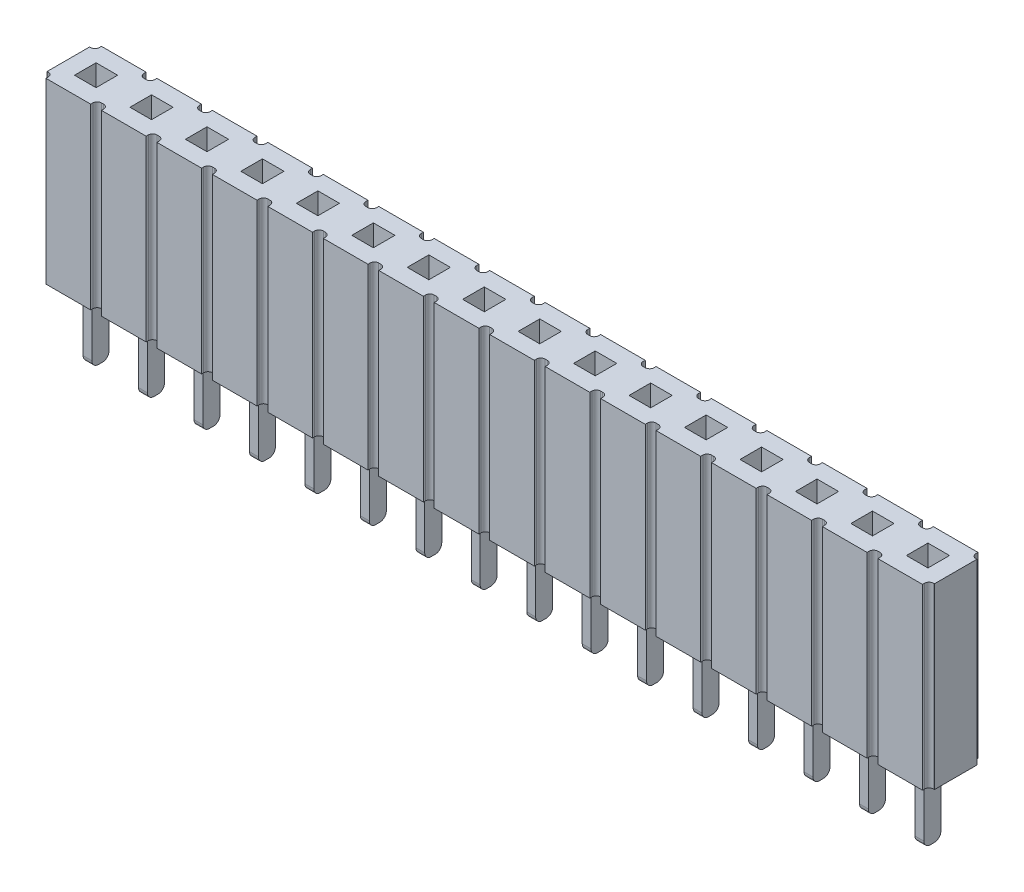
from build123d import *

# Parameters (mm, degrees)
BOSS_EXTRUDE1_DEPTH      = 1.285
BOSS_EXTRUDE1_DEPTH_BACK = 1.285
SKETCH1_W                = 41.12
SKETCH1_H                = 8.26
CUT_EXTRUDE2_DEPTH       = 23.194423286
LPATTERN2_COUNT          = 9
LPATTERN2_PITCH          = 2.57
LPATTERN2_COUNT_DIR2     = 9
LPATTERN2_PITCH_DIR2     = 2.57
MIRROR2_COPY_1_DEPTH     = 23.194423286
MIRROR2_COPY_2_DEPTH     = 23.194423286
MIRROR2_COPY_3_DEPTH     = 23.194423286
MIRROR2_COPY_4_DEPTH     = 23.194423286
MIRROR2_COPY_5_DEPTH     = 23.194423286
MIRROR2_COPY_6_DEPTH     = 23.194423286
MIRROR2_COPY_7_DEPTH     = 23.194423286
MIRROR2_COPY_8_DEPTH     = 23.194423286
MIRROR2_COPY_9_DEPTH     = 23.194423286
MIRROR2_COPY_10_DEPTH    = 23.194423286
MIRROR2_COPY_11_DEPTH    = 23.194423286
MIRROR2_COPY_12_DEPTH    = 23.194423286
MIRROR2_COPY_13_DEPTH    = 23.194423286
MIRROR2_COPY_14_DEPTH    = 23.194423286
MIRROR2_COPY_15_DEPTH    = 23.194423286
MIRROR2_COPY_16_DEPTH    = 23.194423286
MIRROR2_COPY_17_DEPTH    = 23.194423286
MIRROR2_COPY_18_DEPTH    = 23.194423286
MIRROR2_COPY_19_DEPTH    = 23.194423286
MIRROR2_COPY_20_DEPTH    = 23.194423286
MIRROR2_COPY_21_DEPTH    = 23.194423286
MIRROR2_COPY_22_DEPTH    = 23.194423286
MIRROR2_COPY_23_DEPTH    = 23.194423286
MIRROR2_COPY_24_DEPTH    = 23.194423286
MIRROR2_COPY_25_DEPTH    = 23.194423286
MIRROR2_COPY_26_DEPTH    = 23.194423286
MIRROR2_COPY_27_DEPTH    = 23.194423286
MIRROR2_COPY_28_DEPTH    = 23.194423286
MIRROR2_COPY_29_DEPTH    = 23.194423286
MIRROR2_COPY_30_DEPTH    = 23.194423286
MIRROR2_COPY_31_DEPTH    = 23.194423286
MIRROR2_COPY_32_DEPTH    = 23.194423286
MIRROR2_COPY_33_DEPTH    = 23.194423286
MIRROR2_COPY_34_DEPTH    = 23.194423286
MIRROR2_COPY_35_DEPTH    = 23.194423286
MIRROR2_COPY_36_DEPTH    = 23.194423286
MIRROR2_COPY_37_DEPTH    = 23.194423286
MIRROR2_COPY_38_DEPTH    = 23.194423286
MIRROR2_COPY_39_DEPTH    = 23.194423286
MIRROR2_COPY_40_DEPTH    = 23.194423286
MIRROR2_COPY_41_DEPTH    = 23.194423286
MIRROR2_COPY_42_DEPTH    = 23.194423286
MIRROR2_COPY_43_DEPTH    = 23.194423286
MIRROR2_COPY_44_DEPTH    = 23.194423286
MIRROR2_COPY_45_DEPTH    = 23.194423286
MIRROR2_COPY_46_DEPTH    = 23.194423286
MIRROR2_COPY_47_DEPTH    = 23.194423286
MIRROR2_COPY_48_DEPTH    = 23.194423286
MIRROR2_COPY_49_DEPTH    = 23.194423286
MIRROR2_COPY_50_DEPTH    = 23.194423286
MIRROR2_COPY_51_DEPTH    = 23.194423286
MIRROR2_COPY_52_DEPTH    = 23.194423286
MIRROR2_COPY_53_DEPTH    = 23.194423286
MIRROR2_COPY_54_DEPTH    = 23.194423286
MIRROR2_COPY_55_DEPTH    = 23.194423286
MIRROR2_COPY_56_DEPTH    = 23.194423286
MIRROR2_COPY_57_DEPTH    = 23.194423286
MIRROR2_COPY_58_DEPTH    = 23.194423286
MIRROR2_COPY_59_DEPTH    = 23.194423286
MIRROR2_COPY_60_DEPTH    = 23.194423286
MIRROR2_COPY_61_DEPTH    = 23.194423286
MIRROR2_COPY_62_DEPTH    = 23.194423286
MIRROR2_COPY_63_DEPTH    = 23.194423286
MIRROR2_COPY_64_DEPTH    = 23.194423286
MIRROR2_COPY_65_DEPTH    = 23.194423286
MIRROR2_COPY_66_DEPTH    = 23.194423286
MIRROR2_COPY_67_DEPTH    = 23.194423286
MIRROR2_COPY_68_DEPTH    = 23.194423286
MIRROR2_COPY_69_DEPTH    = 23.194423286
MIRROR2_COPY_70_DEPTH    = 23.194423286
MIRROR2_COPY_71_DEPTH    = 23.194423286
MIRROR2_COPY_72_DEPTH    = 23.194423286
MIRROR2_COPY_73_DEPTH    = 23.194423286
MIRROR2_COPY_74_DEPTH    = 23.194423286
MIRROR2_COPY_75_DEPTH    = 23.194423286
MIRROR2_COPY_76_DEPTH    = 23.194423286
MIRROR2_COPY_77_DEPTH    = 23.194423286
MIRROR2_COPY_78_DEPTH    = 23.194423286
MIRROR2_COPY_79_DEPTH    = 23.194423286
MIRROR2_COPY_80_DEPTH    = 23.194423286
MIRROR2_COPY_81_DEPTH    = 23.194423286
SKETCH4_W                = 1
SKETCH4_H                = 1
CUT_EXTRUDE3_DEPTH       = 8
LPATTERN3_COUNT          = 9
LPATTERN3_PITCH          = 2.57
LPATTERN3_COUNT_DIR2     = 8
LPATTERN3_PITCH_DIR2     = 2.57
SKETCH5_W                = 0.41
SKETCH5_H                = 0.79
BOSS_EXTRUDE2_DEPTH      = 3.2
LPATTERN6_COUNT          = 9
LPATTERN6_PITCH          = 2.57
LPATTERN6_COUNT_DIR2     = 8
LPATTERN6_PITCH_DIR2     = 2.57
FILLET2_R                = 0.3


with BuildPart() as part:
    # Sketch1 → Boss-Extrude1 (new, two sides: drawn at the far end of the back side and taken through both)
    with BuildSketch(Plane.XY.offset(-BOSS_EXTRUDE1_DEPTH_BACK)):
        Rectangle(SKETCH1_W, SKETCH1_H)
    extrude(amount=BOSS_EXTRUDE1_DEPTH + BOSS_EXTRUDE1_DEPTH_BACK)

    # Sketch3 → Cut-Extrude2 (cut, through all)
    with BuildSketch(Plane(origin=(0, 4.13, 0), x_dir=(1, 0, 0), z_dir=(0, 1, 0))):
        with BuildLine():
            Line((-0.05, -0.985), (0.05, -0.985))
            ThreePointArc((0.05, -0.985), (0.191421356, -1.043578644), (0.25, -1.185))
            Line((0.25, -1.185), (0.25, -1.285))
            Line((0.25, -1.285), (-0.25, -1.285))
            Line((-0.25, -1.285), (-0.25, -1.185))
            ThreePointArc((-0.25, -1.185), (-0.191421356, -1.043578644), (-0.05, -0.985))
        make_face()
    cut_extrude2 = extrude(amount=-CUT_EXTRUDE2_DEPTH, mode=Mode.SUBTRACT)

    # LPattern2: Cut-Extrude2 9 × 9
    with Locations(*[Vector(-1, 0, 0) * (i * LPATTERN2_PITCH) + Vector(1, 0, 0) * (j * LPATTERN2_PITCH_DIR2) for i in range(LPATTERN2_COUNT) for j in range(LPATTERN2_COUNT_DIR2) if (i, j) != (0, 0)]):
        add(cut_extrude2, mode=Mode.SUBTRACT)

    # Mirror2 copy 1 sketch → Mirror2 copy 1 (cut, through all)
    with BuildSketch(Plane(origin=(2.57, 4.13, 0), x_dir=(1, 0, 0), z_dir=(0, 1, 0))):
        with BuildLine():
            Line((-0.05, 0.985), (0.05, 0.985))
            ThreePointArc((0.05, 0.985), (0.191421356, 1.043578644), (0.25, 1.185))
            Line((0.25, 1.185), (0.25, 1.285))
            Line((0.25, 1.285), (-0.25, 1.285))
            Line((-0.25, 1.285), (-0.25, 1.185))
            ThreePointArc((-0.25, 1.185), (-0.191421356, 1.043578644), (-0.05, 0.985))
        make_face()
    extrude(amount=-MIRROR2_COPY_1_DEPTH, mode=Mode.SUBTRACT)

    # Mirror2 copy 2 sketch → Mirror2 copy 2 (cut, through all)
    with BuildSketch(Plane(origin=(5.14, 4.13, 0), x_dir=(1, 0, 0), z_dir=(0, 1, 0))):
        with BuildLine():
            Line((-0.05, 0.985), (0.05, 0.985))
            ThreePointArc((0.05, 0.985), (0.191421356, 1.043578644), (0.25, 1.185))
            Line((0.25, 1.185), (0.25, 1.285))
            Line((0.25, 1.285), (-0.25, 1.285))
            Line((-0.25, 1.285), (-0.25, 1.185))
            ThreePointArc((-0.25, 1.185), (-0.191421356, 1.043578644), (-0.05, 0.985))
        make_face()
    extrude(amount=-MIRROR2_COPY_2_DEPTH, mode=Mode.SUBTRACT)

    # Mirror2 copy 3 sketch → Mirror2 copy 3 (cut, through all)
    with BuildSketch(Plane(origin=(7.71, 4.13, 0), x_dir=(1, 0, 0), z_dir=(0, 1, 0))):
        with BuildLine():
            Line((-0.05, 0.985), (0.05, 0.985))
            ThreePointArc((0.05, 0.985), (0.191421356, 1.043578644), (0.25, 1.185))
            Line((0.25, 1.185), (0.25, 1.285))
            Line((0.25, 1.285), (-0.25, 1.285))
            Line((-0.25, 1.285), (-0.25, 1.185))
            ThreePointArc((-0.25, 1.185), (-0.191421356, 1.043578644), (-0.05, 0.985))
        make_face()
    extrude(amount=-MIRROR2_COPY_3_DEPTH, mode=Mode.SUBTRACT)

    # Mirror2 copy 4 sketch → Mirror2 copy 4 (cut, through all)
    with BuildSketch(Plane(origin=(10.28, 4.13, 0), x_dir=(1, 0, 0), z_dir=(0, 1, 0))):
        with BuildLine():
            Line((-0.05, 0.985), (0.05, 0.985))
            ThreePointArc((0.05, 0.985), (0.191421356, 1.043578644), (0.25, 1.185))
            Line((0.25, 1.185), (0.25, 1.285))
            Line((0.25, 1.285), (-0.25, 1.285))
            Line((-0.25, 1.285), (-0.25, 1.185))
            ThreePointArc((-0.25, 1.185), (-0.191421356, 1.043578644), (-0.05, 0.985))
        make_face()
    extrude(amount=-MIRROR2_COPY_4_DEPTH, mode=Mode.SUBTRACT)

    # Mirror2 copy 5 sketch → Mirror2 copy 5 (cut, through all)
    with BuildSketch(Plane(origin=(12.85, 4.13, 0), x_dir=(1, 0, 0), z_dir=(0, 1, 0))):
        with BuildLine():
            Line((-0.05, 0.985), (0.05, 0.985))
            ThreePointArc((0.05, 0.985), (0.191421356, 1.043578644), (0.25, 1.185))
            Line((0.25, 1.185), (0.25, 1.285))
            Line((0.25, 1.285), (-0.25, 1.285))
            Line((-0.25, 1.285), (-0.25, 1.185))
            ThreePointArc((-0.25, 1.185), (-0.191421356, 1.043578644), (-0.05, 0.985))
        make_face()
    extrude(amount=-MIRROR2_COPY_5_DEPTH, mode=Mode.SUBTRACT)

    # Mirror2 copy 6 sketch → Mirror2 copy 6 (cut, through all)
    with BuildSketch(Plane(origin=(15.42, 4.13, 0), x_dir=(1, 0, 0), z_dir=(0, 1, 0))):
        with BuildLine():
            Line((-0.05, 0.985), (0.05, 0.985))
            ThreePointArc((0.05, 0.985), (0.191421356, 1.043578644), (0.25, 1.185))
            Line((0.25, 1.185), (0.25, 1.285))
            Line((0.25, 1.285), (-0.25, 1.285))
            Line((-0.25, 1.285), (-0.25, 1.185))
            ThreePointArc((-0.25, 1.185), (-0.191421356, 1.043578644), (-0.05, 0.985))
        make_face()
    extrude(amount=-MIRROR2_COPY_6_DEPTH, mode=Mode.SUBTRACT)

    # Mirror2 copy 7 sketch → Mirror2 copy 7 (cut, through all)
    with BuildSketch(Plane(origin=(17.99, 4.13, 0), x_dir=(1, 0, 0), z_dir=(0, 1, 0))):
        with BuildLine():
            Line((-0.05, 0.985), (0.05, 0.985))
            ThreePointArc((0.05, 0.985), (0.191421356, 1.043578644), (0.25, 1.185))
            Line((0.25, 1.185), (0.25, 1.285))
            Line((0.25, 1.285), (-0.25, 1.285))
            Line((-0.25, 1.285), (-0.25, 1.185))
            ThreePointArc((-0.25, 1.185), (-0.191421356, 1.043578644), (-0.05, 0.985))
        make_face()
    extrude(amount=-MIRROR2_COPY_7_DEPTH, mode=Mode.SUBTRACT)

    # Mirror2 copy 8 sketch → Mirror2 copy 8 (cut, through all)
    with BuildSketch(Plane(origin=(20.56, 4.13, 0), x_dir=(1, 0, 0), z_dir=(0, 1, 0))):
        with BuildLine():
            Line((-0.05, 0.985), (0.05, 0.985))
            ThreePointArc((0.05, 0.985), (0.191421356, 1.043578644), (0.25, 1.185))
            Line((0.25, 1.185), (0.25, 1.285))
            Line((0.25, 1.285), (-0.25, 1.285))
            Line((-0.25, 1.285), (-0.25, 1.185))
            ThreePointArc((-0.25, 1.185), (-0.191421356, 1.043578644), (-0.05, 0.985))
        make_face()
    extrude(amount=-MIRROR2_COPY_8_DEPTH, mode=Mode.SUBTRACT)

    # Mirror2 copy 9 sketch → Mirror2 copy 9 (cut, through all)
    with BuildSketch(Plane(origin=(-2.57, 4.13, 0), x_dir=(1, 0, 0), z_dir=(0, 1, 0))):
        with BuildLine():
            Line((-0.05, 0.985), (0.05, 0.985))
            ThreePointArc((0.05, 0.985), (0.191421356, 1.043578644), (0.25, 1.185))
            Line((0.25, 1.185), (0.25, 1.285))
            Line((0.25, 1.285), (-0.25, 1.285))
            Line((-0.25, 1.285), (-0.25, 1.185))
            ThreePointArc((-0.25, 1.185), (-0.191421356, 1.043578644), (-0.05, 0.985))
        make_face()
    extrude(amount=-MIRROR2_COPY_9_DEPTH, mode=Mode.SUBTRACT)

    # Mirror2 copy 10 sketch → Mirror2 copy 10 (cut, through all)
    with BuildSketch(Plane(origin=(0, 4.13, 0), x_dir=(1, 0, 0), z_dir=(0, 1, 0))):
        with BuildLine():
            Line((-0.05, 0.985), (0.05, 0.985))
            ThreePointArc((0.05, 0.985), (0.191421356, 1.043578644), (0.25, 1.185))
            Line((0.25, 1.185), (0.25, 1.285))
            Line((0.25, 1.285), (-0.25, 1.285))
            Line((-0.25, 1.285), (-0.25, 1.185))
            ThreePointArc((-0.25, 1.185), (-0.191421356, 1.043578644), (-0.05, 0.985))
        make_face()
    extrude(amount=-MIRROR2_COPY_10_DEPTH, mode=Mode.SUBTRACT)

    # Mirror2 copy 11 sketch → Mirror2 copy 11 (cut, through all)
    with BuildSketch(Plane(origin=(2.57, 4.13, 0), x_dir=(1, 0, 0), z_dir=(0, 1, 0))):
        with BuildLine():
            Line((-0.05, 0.985), (0.05, 0.985))
            ThreePointArc((0.05, 0.985), (0.191421356, 1.043578644), (0.25, 1.185))
            Line((0.25, 1.185), (0.25, 1.285))
            Line((0.25, 1.285), (-0.25, 1.285))
            Line((-0.25, 1.285), (-0.25, 1.185))
            ThreePointArc((-0.25, 1.185), (-0.191421356, 1.043578644), (-0.05, 0.985))
        make_face()
    extrude(amount=-MIRROR2_COPY_11_DEPTH, mode=Mode.SUBTRACT)

    # Mirror2 copy 12 sketch → Mirror2 copy 12 (cut, through all)
    with BuildSketch(Plane(origin=(5.14, 4.13, 0), x_dir=(1, 0, 0), z_dir=(0, 1, 0))):
        with BuildLine():
            Line((-0.05, 0.985), (0.05, 0.985))
            ThreePointArc((0.05, 0.985), (0.191421356, 1.043578644), (0.25, 1.185))
            Line((0.25, 1.185), (0.25, 1.285))
            Line((0.25, 1.285), (-0.25, 1.285))
            Line((-0.25, 1.285), (-0.25, 1.185))
            ThreePointArc((-0.25, 1.185), (-0.191421356, 1.043578644), (-0.05, 0.985))
        make_face()
    extrude(amount=-MIRROR2_COPY_12_DEPTH, mode=Mode.SUBTRACT)

    # Mirror2 copy 13 sketch → Mirror2 copy 13 (cut, through all)
    with BuildSketch(Plane(origin=(7.71, 4.13, 0), x_dir=(1, 0, 0), z_dir=(0, 1, 0))):
        with BuildLine():
            Line((-0.05, 0.985), (0.05, 0.985))
            ThreePointArc((0.05, 0.985), (0.191421356, 1.043578644), (0.25, 1.185))
            Line((0.25, 1.185), (0.25, 1.285))
            Line((0.25, 1.285), (-0.25, 1.285))
            Line((-0.25, 1.285), (-0.25, 1.185))
            ThreePointArc((-0.25, 1.185), (-0.191421356, 1.043578644), (-0.05, 0.985))
        make_face()
    extrude(amount=-MIRROR2_COPY_13_DEPTH, mode=Mode.SUBTRACT)

    # Mirror2 copy 14 sketch → Mirror2 copy 14 (cut, through all)
    with BuildSketch(Plane(origin=(10.28, 4.13, 0), x_dir=(1, 0, 0), z_dir=(0, 1, 0))):
        with BuildLine():
            Line((-0.05, 0.985), (0.05, 0.985))
            ThreePointArc((0.05, 0.985), (0.191421356, 1.043578644), (0.25, 1.185))
            Line((0.25, 1.185), (0.25, 1.285))
            Line((0.25, 1.285), (-0.25, 1.285))
            Line((-0.25, 1.285), (-0.25, 1.185))
            ThreePointArc((-0.25, 1.185), (-0.191421356, 1.043578644), (-0.05, 0.985))
        make_face()
    extrude(amount=-MIRROR2_COPY_14_DEPTH, mode=Mode.SUBTRACT)

    # Mirror2 copy 15 sketch → Mirror2 copy 15 (cut, through all)
    with BuildSketch(Plane(origin=(12.85, 4.13, 0), x_dir=(1, 0, 0), z_dir=(0, 1, 0))):
        with BuildLine():
            Line((-0.05, 0.985), (0.05, 0.985))
            ThreePointArc((0.05, 0.985), (0.191421356, 1.043578644), (0.25, 1.185))
            Line((0.25, 1.185), (0.25, 1.285))
            Line((0.25, 1.285), (-0.25, 1.285))
            Line((-0.25, 1.285), (-0.25, 1.185))
            ThreePointArc((-0.25, 1.185), (-0.191421356, 1.043578644), (-0.05, 0.985))
        make_face()
    extrude(amount=-MIRROR2_COPY_15_DEPTH, mode=Mode.SUBTRACT)

    # Mirror2 copy 16 sketch → Mirror2 copy 16 (cut, through all)
    with BuildSketch(Plane(origin=(15.42, 4.13, 0), x_dir=(1, 0, 0), z_dir=(0, 1, 0))):
        with BuildLine():
            Line((-0.05, 0.985), (0.05, 0.985))
            ThreePointArc((0.05, 0.985), (0.191421356, 1.043578644), (0.25, 1.185))
            Line((0.25, 1.185), (0.25, 1.285))
            Line((0.25, 1.285), (-0.25, 1.285))
            Line((-0.25, 1.285), (-0.25, 1.185))
            ThreePointArc((-0.25, 1.185), (-0.191421356, 1.043578644), (-0.05, 0.985))
        make_face()
    extrude(amount=-MIRROR2_COPY_16_DEPTH, mode=Mode.SUBTRACT)

    # Mirror2 copy 17 sketch → Mirror2 copy 17 (cut, through all)
    with BuildSketch(Plane(origin=(17.99, 4.13, 0), x_dir=(1, 0, 0), z_dir=(0, 1, 0))):
        with BuildLine():
            Line((-0.05, 0.985), (0.05, 0.985))
            ThreePointArc((0.05, 0.985), (0.191421356, 1.043578644), (0.25, 1.185))
            Line((0.25, 1.185), (0.25, 1.285))
            Line((0.25, 1.285), (-0.25, 1.285))
            Line((-0.25, 1.285), (-0.25, 1.185))
            ThreePointArc((-0.25, 1.185), (-0.191421356, 1.043578644), (-0.05, 0.985))
        make_face()
    extrude(amount=-MIRROR2_COPY_17_DEPTH, mode=Mode.SUBTRACT)

    # Mirror2 copy 18 sketch → Mirror2 copy 18 (cut, through all)
    with BuildSketch(Plane(origin=(-5.14, 4.13, 0), x_dir=(1, 0, 0), z_dir=(0, 1, 0))):
        with BuildLine():
            Line((-0.05, 0.985), (0.05, 0.985))
            ThreePointArc((0.05, 0.985), (0.191421356, 1.043578644), (0.25, 1.185))
            Line((0.25, 1.185), (0.25, 1.285))
            Line((0.25, 1.285), (-0.25, 1.285))
            Line((-0.25, 1.285), (-0.25, 1.185))
            ThreePointArc((-0.25, 1.185), (-0.191421356, 1.043578644), (-0.05, 0.985))
        make_face()
    extrude(amount=-MIRROR2_COPY_18_DEPTH, mode=Mode.SUBTRACT)

    # Mirror2 copy 19 sketch → Mirror2 copy 19 (cut, through all)
    with BuildSketch(Plane(origin=(-2.57, 4.13, 0), x_dir=(1, 0, 0), z_dir=(0, 1, 0))):
        with BuildLine():
            Line((-0.05, 0.985), (0.05, 0.985))
            ThreePointArc((0.05, 0.985), (0.191421356, 1.043578644), (0.25, 1.185))
            Line((0.25, 1.185), (0.25, 1.285))
            Line((0.25, 1.285), (-0.25, 1.285))
            Line((-0.25, 1.285), (-0.25, 1.185))
            ThreePointArc((-0.25, 1.185), (-0.191421356, 1.043578644), (-0.05, 0.985))
        make_face()
    extrude(amount=-MIRROR2_COPY_19_DEPTH, mode=Mode.SUBTRACT)

    # Mirror2 copy 20 sketch → Mirror2 copy 20 (cut, through all)
    with BuildSketch(Plane(origin=(0, 4.13, 0), x_dir=(1, 0, 0), z_dir=(0, 1, 0))):
        with BuildLine():
            Line((-0.05, 0.985), (0.05, 0.985))
            ThreePointArc((0.05, 0.985), (0.191421356, 1.043578644), (0.25, 1.185))
            Line((0.25, 1.185), (0.25, 1.285))
            Line((0.25, 1.285), (-0.25, 1.285))
            Line((-0.25, 1.285), (-0.25, 1.185))
            ThreePointArc((-0.25, 1.185), (-0.191421356, 1.043578644), (-0.05, 0.985))
        make_face()
    extrude(amount=-MIRROR2_COPY_20_DEPTH, mode=Mode.SUBTRACT)

    # Mirror2 copy 21 sketch → Mirror2 copy 21 (cut, through all)
    with BuildSketch(Plane(origin=(2.57, 4.13, 0), x_dir=(1, 0, 0), z_dir=(0, 1, 0))):
        with BuildLine():
            Line((-0.05, 0.985), (0.05, 0.985))
            ThreePointArc((0.05, 0.985), (0.191421356, 1.043578644), (0.25, 1.185))
            Line((0.25, 1.185), (0.25, 1.285))
            Line((0.25, 1.285), (-0.25, 1.285))
            Line((-0.25, 1.285), (-0.25, 1.185))
            ThreePointArc((-0.25, 1.185), (-0.191421356, 1.043578644), (-0.05, 0.985))
        make_face()
    extrude(amount=-MIRROR2_COPY_21_DEPTH, mode=Mode.SUBTRACT)

    # Mirror2 copy 22 sketch → Mirror2 copy 22 (cut, through all)
    with BuildSketch(Plane(origin=(5.14, 4.13, 0), x_dir=(1, 0, 0), z_dir=(0, 1, 0))):
        with BuildLine():
            Line((-0.05, 0.985), (0.05, 0.985))
            ThreePointArc((0.05, 0.985), (0.191421356, 1.043578644), (0.25, 1.185))
            Line((0.25, 1.185), (0.25, 1.285))
            Line((0.25, 1.285), (-0.25, 1.285))
            Line((-0.25, 1.285), (-0.25, 1.185))
            ThreePointArc((-0.25, 1.185), (-0.191421356, 1.043578644), (-0.05, 0.985))
        make_face()
    extrude(amount=-MIRROR2_COPY_22_DEPTH, mode=Mode.SUBTRACT)

    # Mirror2 copy 23 sketch → Mirror2 copy 23 (cut, through all)
    with BuildSketch(Plane(origin=(7.71, 4.13, 0), x_dir=(1, 0, 0), z_dir=(0, 1, 0))):
        with BuildLine():
            Line((-0.05, 0.985), (0.05, 0.985))
            ThreePointArc((0.05, 0.985), (0.191421356, 1.043578644), (0.25, 1.185))
            Line((0.25, 1.185), (0.25, 1.285))
            Line((0.25, 1.285), (-0.25, 1.285))
            Line((-0.25, 1.285), (-0.25, 1.185))
            ThreePointArc((-0.25, 1.185), (-0.191421356, 1.043578644), (-0.05, 0.985))
        make_face()
    extrude(amount=-MIRROR2_COPY_23_DEPTH, mode=Mode.SUBTRACT)

    # Mirror2 copy 24 sketch → Mirror2 copy 24 (cut, through all)
    with BuildSketch(Plane(origin=(10.28, 4.13, 0), x_dir=(1, 0, 0), z_dir=(0, 1, 0))):
        with BuildLine():
            Line((-0.05, 0.985), (0.05, 0.985))
            ThreePointArc((0.05, 0.985), (0.191421356, 1.043578644), (0.25, 1.185))
            Line((0.25, 1.185), (0.25, 1.285))
            Line((0.25, 1.285), (-0.25, 1.285))
            Line((-0.25, 1.285), (-0.25, 1.185))
            ThreePointArc((-0.25, 1.185), (-0.191421356, 1.043578644), (-0.05, 0.985))
        make_face()
    extrude(amount=-MIRROR2_COPY_24_DEPTH, mode=Mode.SUBTRACT)

    # Mirror2 copy 25 sketch → Mirror2 copy 25 (cut, through all)
    with BuildSketch(Plane(origin=(12.85, 4.13, 0), x_dir=(1, 0, 0), z_dir=(0, 1, 0))):
        with BuildLine():
            Line((-0.05, 0.985), (0.05, 0.985))
            ThreePointArc((0.05, 0.985), (0.191421356, 1.043578644), (0.25, 1.185))
            Line((0.25, 1.185), (0.25, 1.285))
            Line((0.25, 1.285), (-0.25, 1.285))
            Line((-0.25, 1.285), (-0.25, 1.185))
            ThreePointArc((-0.25, 1.185), (-0.191421356, 1.043578644), (-0.05, 0.985))
        make_face()
    extrude(amount=-MIRROR2_COPY_25_DEPTH, mode=Mode.SUBTRACT)

    # Mirror2 copy 26 sketch → Mirror2 copy 26 (cut, through all)
    with BuildSketch(Plane(origin=(15.42, 4.13, 0), x_dir=(1, 0, 0), z_dir=(0, 1, 0))):
        with BuildLine():
            Line((-0.05, 0.985), (0.05, 0.985))
            ThreePointArc((0.05, 0.985), (0.191421356, 1.043578644), (0.25, 1.185))
            Line((0.25, 1.185), (0.25, 1.285))
            Line((0.25, 1.285), (-0.25, 1.285))
            Line((-0.25, 1.285), (-0.25, 1.185))
            ThreePointArc((-0.25, 1.185), (-0.191421356, 1.043578644), (-0.05, 0.985))
        make_face()
    extrude(amount=-MIRROR2_COPY_26_DEPTH, mode=Mode.SUBTRACT)

    # Mirror2 copy 27 sketch → Mirror2 copy 27 (cut, through all)
    with BuildSketch(Plane(origin=(-7.71, 4.13, 0), x_dir=(1, 0, 0), z_dir=(0, 1, 0))):
        with BuildLine():
            Line((-0.05, 0.985), (0.05, 0.985))
            ThreePointArc((0.05, 0.985), (0.191421356, 1.043578644), (0.25, 1.185))
            Line((0.25, 1.185), (0.25, 1.285))
            Line((0.25, 1.285), (-0.25, 1.285))
            Line((-0.25, 1.285), (-0.25, 1.185))
            ThreePointArc((-0.25, 1.185), (-0.191421356, 1.043578644), (-0.05, 0.985))
        make_face()
    extrude(amount=-MIRROR2_COPY_27_DEPTH, mode=Mode.SUBTRACT)

    # Mirror2 copy 28 sketch → Mirror2 copy 28 (cut, through all)
    with BuildSketch(Plane(origin=(-5.14, 4.13, 0), x_dir=(1, 0, 0), z_dir=(0, 1, 0))):
        with BuildLine():
            Line((-0.05, 0.985), (0.05, 0.985))
            ThreePointArc((0.05, 0.985), (0.191421356, 1.043578644), (0.25, 1.185))
            Line((0.25, 1.185), (0.25, 1.285))
            Line((0.25, 1.285), (-0.25, 1.285))
            Line((-0.25, 1.285), (-0.25, 1.185))
            ThreePointArc((-0.25, 1.185), (-0.191421356, 1.043578644), (-0.05, 0.985))
        make_face()
    extrude(amount=-MIRROR2_COPY_28_DEPTH, mode=Mode.SUBTRACT)

    # Mirror2 copy 29 sketch → Mirror2 copy 29 (cut, through all)
    with BuildSketch(Plane(origin=(-2.57, 4.13, 0), x_dir=(1, 0, 0), z_dir=(0, 1, 0))):
        with BuildLine():
            Line((-0.05, 0.985), (0.05, 0.985))
            ThreePointArc((0.05, 0.985), (0.191421356, 1.043578644), (0.25, 1.185))
            Line((0.25, 1.185), (0.25, 1.285))
            Line((0.25, 1.285), (-0.25, 1.285))
            Line((-0.25, 1.285), (-0.25, 1.185))
            ThreePointArc((-0.25, 1.185), (-0.191421356, 1.043578644), (-0.05, 0.985))
        make_face()
    extrude(amount=-MIRROR2_COPY_29_DEPTH, mode=Mode.SUBTRACT)

    # Mirror2 copy 30 sketch → Mirror2 copy 30 (cut, through all)
    with BuildSketch(Plane(origin=(0, 4.13, 0), x_dir=(1, 0, 0), z_dir=(0, 1, 0))):
        with BuildLine():
            Line((-0.05, 0.985), (0.05, 0.985))
            ThreePointArc((0.05, 0.985), (0.191421356, 1.043578644), (0.25, 1.185))
            Line((0.25, 1.185), (0.25, 1.285))
            Line((0.25, 1.285), (-0.25, 1.285))
            Line((-0.25, 1.285), (-0.25, 1.185))
            ThreePointArc((-0.25, 1.185), (-0.191421356, 1.043578644), (-0.05, 0.985))
        make_face()
    extrude(amount=-MIRROR2_COPY_30_DEPTH, mode=Mode.SUBTRACT)

    # Mirror2 copy 31 sketch → Mirror2 copy 31 (cut, through all)
    with BuildSketch(Plane(origin=(2.57, 4.13, 0), x_dir=(1, 0, 0), z_dir=(0, 1, 0))):
        with BuildLine():
            Line((-0.05, 0.985), (0.05, 0.985))
            ThreePointArc((0.05, 0.985), (0.191421356, 1.043578644), (0.25, 1.185))
            Line((0.25, 1.185), (0.25, 1.285))
            Line((0.25, 1.285), (-0.25, 1.285))
            Line((-0.25, 1.285), (-0.25, 1.185))
            ThreePointArc((-0.25, 1.185), (-0.191421356, 1.043578644), (-0.05, 0.985))
        make_face()
    extrude(amount=-MIRROR2_COPY_31_DEPTH, mode=Mode.SUBTRACT)

    # Mirror2 copy 32 sketch → Mirror2 copy 32 (cut, through all)
    with BuildSketch(Plane(origin=(5.14, 4.13, 0), x_dir=(1, 0, 0), z_dir=(0, 1, 0))):
        with BuildLine():
            Line((-0.05, 0.985), (0.05, 0.985))
            ThreePointArc((0.05, 0.985), (0.191421356, 1.043578644), (0.25, 1.185))
            Line((0.25, 1.185), (0.25, 1.285))
            Line((0.25, 1.285), (-0.25, 1.285))
            Line((-0.25, 1.285), (-0.25, 1.185))
            ThreePointArc((-0.25, 1.185), (-0.191421356, 1.043578644), (-0.05, 0.985))
        make_face()
    extrude(amount=-MIRROR2_COPY_32_DEPTH, mode=Mode.SUBTRACT)

    # Mirror2 copy 33 sketch → Mirror2 copy 33 (cut, through all)
    with BuildSketch(Plane(origin=(7.71, 4.13, 0), x_dir=(1, 0, 0), z_dir=(0, 1, 0))):
        with BuildLine():
            Line((-0.05, 0.985), (0.05, 0.985))
            ThreePointArc((0.05, 0.985), (0.191421356, 1.043578644), (0.25, 1.185))
            Line((0.25, 1.185), (0.25, 1.285))
            Line((0.25, 1.285), (-0.25, 1.285))
            Line((-0.25, 1.285), (-0.25, 1.185))
            ThreePointArc((-0.25, 1.185), (-0.191421356, 1.043578644), (-0.05, 0.985))
        make_face()
    extrude(amount=-MIRROR2_COPY_33_DEPTH, mode=Mode.SUBTRACT)

    # Mirror2 copy 34 sketch → Mirror2 copy 34 (cut, through all)
    with BuildSketch(Plane(origin=(10.28, 4.13, 0), x_dir=(1, 0, 0), z_dir=(0, 1, 0))):
        with BuildLine():
            Line((-0.05, 0.985), (0.05, 0.985))
            ThreePointArc((0.05, 0.985), (0.191421356, 1.043578644), (0.25, 1.185))
            Line((0.25, 1.185), (0.25, 1.285))
            Line((0.25, 1.285), (-0.25, 1.285))
            Line((-0.25, 1.285), (-0.25, 1.185))
            ThreePointArc((-0.25, 1.185), (-0.191421356, 1.043578644), (-0.05, 0.985))
        make_face()
    extrude(amount=-MIRROR2_COPY_34_DEPTH, mode=Mode.SUBTRACT)

    # Mirror2 copy 35 sketch → Mirror2 copy 35 (cut, through all)
    with BuildSketch(Plane(origin=(12.85, 4.13, 0), x_dir=(1, 0, 0), z_dir=(0, 1, 0))):
        with BuildLine():
            Line((-0.05, 0.985), (0.05, 0.985))
            ThreePointArc((0.05, 0.985), (0.191421356, 1.043578644), (0.25, 1.185))
            Line((0.25, 1.185), (0.25, 1.285))
            Line((0.25, 1.285), (-0.25, 1.285))
            Line((-0.25, 1.285), (-0.25, 1.185))
            ThreePointArc((-0.25, 1.185), (-0.191421356, 1.043578644), (-0.05, 0.985))
        make_face()
    extrude(amount=-MIRROR2_COPY_35_DEPTH, mode=Mode.SUBTRACT)

    # Mirror2 copy 36 sketch → Mirror2 copy 36 (cut, through all)
    with BuildSketch(Plane(origin=(-10.28, 4.13, 0), x_dir=(1, 0, 0), z_dir=(0, 1, 0))):
        with BuildLine():
            Line((-0.05, 0.985), (0.05, 0.985))
            ThreePointArc((0.05, 0.985), (0.191421356, 1.043578644), (0.25, 1.185))
            Line((0.25, 1.185), (0.25, 1.285))
            Line((0.25, 1.285), (-0.25, 1.285))
            Line((-0.25, 1.285), (-0.25, 1.185))
            ThreePointArc((-0.25, 1.185), (-0.191421356, 1.043578644), (-0.05, 0.985))
        make_face()
    extrude(amount=-MIRROR2_COPY_36_DEPTH, mode=Mode.SUBTRACT)

    # Mirror2 copy 37 sketch → Mirror2 copy 37 (cut, through all)
    with BuildSketch(Plane(origin=(-7.71, 4.13, 0), x_dir=(1, 0, 0), z_dir=(0, 1, 0))):
        with BuildLine():
            Line((-0.05, 0.985), (0.05, 0.985))
            ThreePointArc((0.05, 0.985), (0.191421356, 1.043578644), (0.25, 1.185))
            Line((0.25, 1.185), (0.25, 1.285))
            Line((0.25, 1.285), (-0.25, 1.285))
            Line((-0.25, 1.285), (-0.25, 1.185))
            ThreePointArc((-0.25, 1.185), (-0.191421356, 1.043578644), (-0.05, 0.985))
        make_face()
    extrude(amount=-MIRROR2_COPY_37_DEPTH, mode=Mode.SUBTRACT)

    # Mirror2 copy 38 sketch → Mirror2 copy 38 (cut, through all)
    with BuildSketch(Plane(origin=(-5.14, 4.13, 0), x_dir=(1, 0, 0), z_dir=(0, 1, 0))):
        with BuildLine():
            Line((-0.05, 0.985), (0.05, 0.985))
            ThreePointArc((0.05, 0.985), (0.191421356, 1.043578644), (0.25, 1.185))
            Line((0.25, 1.185), (0.25, 1.285))
            Line((0.25, 1.285), (-0.25, 1.285))
            Line((-0.25, 1.285), (-0.25, 1.185))
            ThreePointArc((-0.25, 1.185), (-0.191421356, 1.043578644), (-0.05, 0.985))
        make_face()
    extrude(amount=-MIRROR2_COPY_38_DEPTH, mode=Mode.SUBTRACT)

    # Mirror2 copy 39 sketch → Mirror2 copy 39 (cut, through all)
    with BuildSketch(Plane(origin=(-2.57, 4.13, 0), x_dir=(1, 0, 0), z_dir=(0, 1, 0))):
        with BuildLine():
            Line((-0.05, 0.985), (0.05, 0.985))
            ThreePointArc((0.05, 0.985), (0.191421356, 1.043578644), (0.25, 1.185))
            Line((0.25, 1.185), (0.25, 1.285))
            Line((0.25, 1.285), (-0.25, 1.285))
            Line((-0.25, 1.285), (-0.25, 1.185))
            ThreePointArc((-0.25, 1.185), (-0.191421356, 1.043578644), (-0.05, 0.985))
        make_face()
    extrude(amount=-MIRROR2_COPY_39_DEPTH, mode=Mode.SUBTRACT)

    # Mirror2 copy 40 sketch → Mirror2 copy 40 (cut, through all)
    with BuildSketch(Plane(origin=(0, 4.13, 0), x_dir=(1, 0, 0), z_dir=(0, 1, 0))):
        with BuildLine():
            Line((-0.05, 0.985), (0.05, 0.985))
            ThreePointArc((0.05, 0.985), (0.191421356, 1.043578644), (0.25, 1.185))
            Line((0.25, 1.185), (0.25, 1.285))
            Line((0.25, 1.285), (-0.25, 1.285))
            Line((-0.25, 1.285), (-0.25, 1.185))
            ThreePointArc((-0.25, 1.185), (-0.191421356, 1.043578644), (-0.05, 0.985))
        make_face()
    extrude(amount=-MIRROR2_COPY_40_DEPTH, mode=Mode.SUBTRACT)

    # Mirror2 copy 41 sketch → Mirror2 copy 41 (cut, through all)
    with BuildSketch(Plane(origin=(2.57, 4.13, 0), x_dir=(1, 0, 0), z_dir=(0, 1, 0))):
        with BuildLine():
            Line((-0.05, 0.985), (0.05, 0.985))
            ThreePointArc((0.05, 0.985), (0.191421356, 1.043578644), (0.25, 1.185))
            Line((0.25, 1.185), (0.25, 1.285))
            Line((0.25, 1.285), (-0.25, 1.285))
            Line((-0.25, 1.285), (-0.25, 1.185))
            ThreePointArc((-0.25, 1.185), (-0.191421356, 1.043578644), (-0.05, 0.985))
        make_face()
    extrude(amount=-MIRROR2_COPY_41_DEPTH, mode=Mode.SUBTRACT)

    # Mirror2 copy 42 sketch → Mirror2 copy 42 (cut, through all)
    with BuildSketch(Plane(origin=(5.14, 4.13, 0), x_dir=(1, 0, 0), z_dir=(0, 1, 0))):
        with BuildLine():
            Line((-0.05, 0.985), (0.05, 0.985))
            ThreePointArc((0.05, 0.985), (0.191421356, 1.043578644), (0.25, 1.185))
            Line((0.25, 1.185), (0.25, 1.285))
            Line((0.25, 1.285), (-0.25, 1.285))
            Line((-0.25, 1.285), (-0.25, 1.185))
            ThreePointArc((-0.25, 1.185), (-0.191421356, 1.043578644), (-0.05, 0.985))
        make_face()
    extrude(amount=-MIRROR2_COPY_42_DEPTH, mode=Mode.SUBTRACT)

    # Mirror2 copy 43 sketch → Mirror2 copy 43 (cut, through all)
    with BuildSketch(Plane(origin=(7.71, 4.13, 0), x_dir=(1, 0, 0), z_dir=(0, 1, 0))):
        with BuildLine():
            Line((-0.05, 0.985), (0.05, 0.985))
            ThreePointArc((0.05, 0.985), (0.191421356, 1.043578644), (0.25, 1.185))
            Line((0.25, 1.185), (0.25, 1.285))
            Line((0.25, 1.285), (-0.25, 1.285))
            Line((-0.25, 1.285), (-0.25, 1.185))
            ThreePointArc((-0.25, 1.185), (-0.191421356, 1.043578644), (-0.05, 0.985))
        make_face()
    extrude(amount=-MIRROR2_COPY_43_DEPTH, mode=Mode.SUBTRACT)

    # Mirror2 copy 44 sketch → Mirror2 copy 44 (cut, through all)
    with BuildSketch(Plane(origin=(10.28, 4.13, 0), x_dir=(1, 0, 0), z_dir=(0, 1, 0))):
        with BuildLine():
            Line((-0.05, 0.985), (0.05, 0.985))
            ThreePointArc((0.05, 0.985), (0.191421356, 1.043578644), (0.25, 1.185))
            Line((0.25, 1.185), (0.25, 1.285))
            Line((0.25, 1.285), (-0.25, 1.285))
            Line((-0.25, 1.285), (-0.25, 1.185))
            ThreePointArc((-0.25, 1.185), (-0.191421356, 1.043578644), (-0.05, 0.985))
        make_face()
    extrude(amount=-MIRROR2_COPY_44_DEPTH, mode=Mode.SUBTRACT)

    # Mirror2 copy 45 sketch → Mirror2 copy 45 (cut, through all)
    with BuildSketch(Plane(origin=(-12.85, 4.13, 0), x_dir=(1, 0, 0), z_dir=(0, 1, 0))):
        with BuildLine():
            Line((-0.05, 0.985), (0.05, 0.985))
            ThreePointArc((0.05, 0.985), (0.191421356, 1.043578644), (0.25, 1.185))
            Line((0.25, 1.185), (0.25, 1.285))
            Line((0.25, 1.285), (-0.25, 1.285))
            Line((-0.25, 1.285), (-0.25, 1.185))
            ThreePointArc((-0.25, 1.185), (-0.191421356, 1.043578644), (-0.05, 0.985))
        make_face()
    extrude(amount=-MIRROR2_COPY_45_DEPTH, mode=Mode.SUBTRACT)

    # Mirror2 copy 46 sketch → Mirror2 copy 46 (cut, through all)
    with BuildSketch(Plane(origin=(-10.28, 4.13, 0), x_dir=(1, 0, 0), z_dir=(0, 1, 0))):
        with BuildLine():
            Line((-0.05, 0.985), (0.05, 0.985))
            ThreePointArc((0.05, 0.985), (0.191421356, 1.043578644), (0.25, 1.185))
            Line((0.25, 1.185), (0.25, 1.285))
            Line((0.25, 1.285), (-0.25, 1.285))
            Line((-0.25, 1.285), (-0.25, 1.185))
            ThreePointArc((-0.25, 1.185), (-0.191421356, 1.043578644), (-0.05, 0.985))
        make_face()
    extrude(amount=-MIRROR2_COPY_46_DEPTH, mode=Mode.SUBTRACT)

    # Mirror2 copy 47 sketch → Mirror2 copy 47 (cut, through all)
    with BuildSketch(Plane(origin=(-7.71, 4.13, 0), x_dir=(1, 0, 0), z_dir=(0, 1, 0))):
        with BuildLine():
            Line((-0.05, 0.985), (0.05, 0.985))
            ThreePointArc((0.05, 0.985), (0.191421356, 1.043578644), (0.25, 1.185))
            Line((0.25, 1.185), (0.25, 1.285))
            Line((0.25, 1.285), (-0.25, 1.285))
            Line((-0.25, 1.285), (-0.25, 1.185))
            ThreePointArc((-0.25, 1.185), (-0.191421356, 1.043578644), (-0.05, 0.985))
        make_face()
    extrude(amount=-MIRROR2_COPY_47_DEPTH, mode=Mode.SUBTRACT)

    # Mirror2 copy 48 sketch → Mirror2 copy 48 (cut, through all)
    with BuildSketch(Plane(origin=(-5.14, 4.13, 0), x_dir=(1, 0, 0), z_dir=(0, 1, 0))):
        with BuildLine():
            Line((-0.05, 0.985), (0.05, 0.985))
            ThreePointArc((0.05, 0.985), (0.191421356, 1.043578644), (0.25, 1.185))
            Line((0.25, 1.185), (0.25, 1.285))
            Line((0.25, 1.285), (-0.25, 1.285))
            Line((-0.25, 1.285), (-0.25, 1.185))
            ThreePointArc((-0.25, 1.185), (-0.191421356, 1.043578644), (-0.05, 0.985))
        make_face()
    extrude(amount=-MIRROR2_COPY_48_DEPTH, mode=Mode.SUBTRACT)

    # Mirror2 copy 49 sketch → Mirror2 copy 49 (cut, through all)
    with BuildSketch(Plane(origin=(-2.57, 4.13, 0), x_dir=(1, 0, 0), z_dir=(0, 1, 0))):
        with BuildLine():
            Line((-0.05, 0.985), (0.05, 0.985))
            ThreePointArc((0.05, 0.985), (0.191421356, 1.043578644), (0.25, 1.185))
            Line((0.25, 1.185), (0.25, 1.285))
            Line((0.25, 1.285), (-0.25, 1.285))
            Line((-0.25, 1.285), (-0.25, 1.185))
            ThreePointArc((-0.25, 1.185), (-0.191421356, 1.043578644), (-0.05, 0.985))
        make_face()
    extrude(amount=-MIRROR2_COPY_49_DEPTH, mode=Mode.SUBTRACT)

    # Mirror2 copy 50 sketch → Mirror2 copy 50 (cut, through all)
    with BuildSketch(Plane(origin=(0, 4.13, 0), x_dir=(1, 0, 0), z_dir=(0, 1, 0))):
        with BuildLine():
            Line((-0.05, 0.985), (0.05, 0.985))
            ThreePointArc((0.05, 0.985), (0.191421356, 1.043578644), (0.25, 1.185))
            Line((0.25, 1.185), (0.25, 1.285))
            Line((0.25, 1.285), (-0.25, 1.285))
            Line((-0.25, 1.285), (-0.25, 1.185))
            ThreePointArc((-0.25, 1.185), (-0.191421356, 1.043578644), (-0.05, 0.985))
        make_face()
    extrude(amount=-MIRROR2_COPY_50_DEPTH, mode=Mode.SUBTRACT)

    # Mirror2 copy 51 sketch → Mirror2 copy 51 (cut, through all)
    with BuildSketch(Plane(origin=(2.57, 4.13, 0), x_dir=(1, 0, 0), z_dir=(0, 1, 0))):
        with BuildLine():
            Line((-0.05, 0.985), (0.05, 0.985))
            ThreePointArc((0.05, 0.985), (0.191421356, 1.043578644), (0.25, 1.185))
            Line((0.25, 1.185), (0.25, 1.285))
            Line((0.25, 1.285), (-0.25, 1.285))
            Line((-0.25, 1.285), (-0.25, 1.185))
            ThreePointArc((-0.25, 1.185), (-0.191421356, 1.043578644), (-0.05, 0.985))
        make_face()
    extrude(amount=-MIRROR2_COPY_51_DEPTH, mode=Mode.SUBTRACT)

    # Mirror2 copy 52 sketch → Mirror2 copy 52 (cut, through all)
    with BuildSketch(Plane(origin=(5.14, 4.13, 0), x_dir=(1, 0, 0), z_dir=(0, 1, 0))):
        with BuildLine():
            Line((-0.05, 0.985), (0.05, 0.985))
            ThreePointArc((0.05, 0.985), (0.191421356, 1.043578644), (0.25, 1.185))
            Line((0.25, 1.185), (0.25, 1.285))
            Line((0.25, 1.285), (-0.25, 1.285))
            Line((-0.25, 1.285), (-0.25, 1.185))
            ThreePointArc((-0.25, 1.185), (-0.191421356, 1.043578644), (-0.05, 0.985))
        make_face()
    extrude(amount=-MIRROR2_COPY_52_DEPTH, mode=Mode.SUBTRACT)

    # Mirror2 copy 53 sketch → Mirror2 copy 53 (cut, through all)
    with BuildSketch(Plane(origin=(7.71, 4.13, 0), x_dir=(1, 0, 0), z_dir=(0, 1, 0))):
        with BuildLine():
            Line((-0.05, 0.985), (0.05, 0.985))
            ThreePointArc((0.05, 0.985), (0.191421356, 1.043578644), (0.25, 1.185))
            Line((0.25, 1.185), (0.25, 1.285))
            Line((0.25, 1.285), (-0.25, 1.285))
            Line((-0.25, 1.285), (-0.25, 1.185))
            ThreePointArc((-0.25, 1.185), (-0.191421356, 1.043578644), (-0.05, 0.985))
        make_face()
    extrude(amount=-MIRROR2_COPY_53_DEPTH, mode=Mode.SUBTRACT)

    # Mirror2 copy 54 sketch → Mirror2 copy 54 (cut, through all)
    with BuildSketch(Plane(origin=(-15.42, 4.13, 0), x_dir=(1, 0, 0), z_dir=(0, 1, 0))):
        with BuildLine():
            Line((-0.05, 0.985), (0.05, 0.985))
            ThreePointArc((0.05, 0.985), (0.191421356, 1.043578644), (0.25, 1.185))
            Line((0.25, 1.185), (0.25, 1.285))
            Line((0.25, 1.285), (-0.25, 1.285))
            Line((-0.25, 1.285), (-0.25, 1.185))
            ThreePointArc((-0.25, 1.185), (-0.191421356, 1.043578644), (-0.05, 0.985))
        make_face()
    extrude(amount=-MIRROR2_COPY_54_DEPTH, mode=Mode.SUBTRACT)

    # Mirror2 copy 55 sketch → Mirror2 copy 55 (cut, through all)
    with BuildSketch(Plane(origin=(-12.85, 4.13, 0), x_dir=(1, 0, 0), z_dir=(0, 1, 0))):
        with BuildLine():
            Line((-0.05, 0.985), (0.05, 0.985))
            ThreePointArc((0.05, 0.985), (0.191421356, 1.043578644), (0.25, 1.185))
            Line((0.25, 1.185), (0.25, 1.285))
            Line((0.25, 1.285), (-0.25, 1.285))
            Line((-0.25, 1.285), (-0.25, 1.185))
            ThreePointArc((-0.25, 1.185), (-0.191421356, 1.043578644), (-0.05, 0.985))
        make_face()
    extrude(amount=-MIRROR2_COPY_55_DEPTH, mode=Mode.SUBTRACT)

    # Mirror2 copy 56 sketch → Mirror2 copy 56 (cut, through all)
    with BuildSketch(Plane(origin=(-10.28, 4.13, 0), x_dir=(1, 0, 0), z_dir=(0, 1, 0))):
        with BuildLine():
            Line((-0.05, 0.985), (0.05, 0.985))
            ThreePointArc((0.05, 0.985), (0.191421356, 1.043578644), (0.25, 1.185))
            Line((0.25, 1.185), (0.25, 1.285))
            Line((0.25, 1.285), (-0.25, 1.285))
            Line((-0.25, 1.285), (-0.25, 1.185))
            ThreePointArc((-0.25, 1.185), (-0.191421356, 1.043578644), (-0.05, 0.985))
        make_face()
    extrude(amount=-MIRROR2_COPY_56_DEPTH, mode=Mode.SUBTRACT)

    # Mirror2 copy 57 sketch → Mirror2 copy 57 (cut, through all)
    with BuildSketch(Plane(origin=(-7.71, 4.13, 0), x_dir=(1, 0, 0), z_dir=(0, 1, 0))):
        with BuildLine():
            Line((-0.05, 0.985), (0.05, 0.985))
            ThreePointArc((0.05, 0.985), (0.191421356, 1.043578644), (0.25, 1.185))
            Line((0.25, 1.185), (0.25, 1.285))
            Line((0.25, 1.285), (-0.25, 1.285))
            Line((-0.25, 1.285), (-0.25, 1.185))
            ThreePointArc((-0.25, 1.185), (-0.191421356, 1.043578644), (-0.05, 0.985))
        make_face()
    extrude(amount=-MIRROR2_COPY_57_DEPTH, mode=Mode.SUBTRACT)

    # Mirror2 copy 58 sketch → Mirror2 copy 58 (cut, through all)
    with BuildSketch(Plane(origin=(-5.14, 4.13, 0), x_dir=(1, 0, 0), z_dir=(0, 1, 0))):
        with BuildLine():
            Line((-0.05, 0.985), (0.05, 0.985))
            ThreePointArc((0.05, 0.985), (0.191421356, 1.043578644), (0.25, 1.185))
            Line((0.25, 1.185), (0.25, 1.285))
            Line((0.25, 1.285), (-0.25, 1.285))
            Line((-0.25, 1.285), (-0.25, 1.185))
            ThreePointArc((-0.25, 1.185), (-0.191421356, 1.043578644), (-0.05, 0.985))
        make_face()
    extrude(amount=-MIRROR2_COPY_58_DEPTH, mode=Mode.SUBTRACT)

    # Mirror2 copy 59 sketch → Mirror2 copy 59 (cut, through all)
    with BuildSketch(Plane(origin=(-2.57, 4.13, 0), x_dir=(1, 0, 0), z_dir=(0, 1, 0))):
        with BuildLine():
            Line((-0.05, 0.985), (0.05, 0.985))
            ThreePointArc((0.05, 0.985), (0.191421356, 1.043578644), (0.25, 1.185))
            Line((0.25, 1.185), (0.25, 1.285))
            Line((0.25, 1.285), (-0.25, 1.285))
            Line((-0.25, 1.285), (-0.25, 1.185))
            ThreePointArc((-0.25, 1.185), (-0.191421356, 1.043578644), (-0.05, 0.985))
        make_face()
    extrude(amount=-MIRROR2_COPY_59_DEPTH, mode=Mode.SUBTRACT)

    # Mirror2 copy 60 sketch → Mirror2 copy 60 (cut, through all)
    with BuildSketch(Plane(origin=(0, 4.13, 0), x_dir=(1, 0, 0), z_dir=(0, 1, 0))):
        with BuildLine():
            Line((-0.05, 0.985), (0.05, 0.985))
            ThreePointArc((0.05, 0.985), (0.191421356, 1.043578644), (0.25, 1.185))
            Line((0.25, 1.185), (0.25, 1.285))
            Line((0.25, 1.285), (-0.25, 1.285))
            Line((-0.25, 1.285), (-0.25, 1.185))
            ThreePointArc((-0.25, 1.185), (-0.191421356, 1.043578644), (-0.05, 0.985))
        make_face()
    extrude(amount=-MIRROR2_COPY_60_DEPTH, mode=Mode.SUBTRACT)

    # Mirror2 copy 61 sketch → Mirror2 copy 61 (cut, through all)
    with BuildSketch(Plane(origin=(2.57, 4.13, 0), x_dir=(1, 0, 0), z_dir=(0, 1, 0))):
        with BuildLine():
            Line((-0.05, 0.985), (0.05, 0.985))
            ThreePointArc((0.05, 0.985), (0.191421356, 1.043578644), (0.25, 1.185))
            Line((0.25, 1.185), (0.25, 1.285))
            Line((0.25, 1.285), (-0.25, 1.285))
            Line((-0.25, 1.285), (-0.25, 1.185))
            ThreePointArc((-0.25, 1.185), (-0.191421356, 1.043578644), (-0.05, 0.985))
        make_face()
    extrude(amount=-MIRROR2_COPY_61_DEPTH, mode=Mode.SUBTRACT)

    # Mirror2 copy 62 sketch → Mirror2 copy 62 (cut, through all)
    with BuildSketch(Plane(origin=(5.14, 4.13, 0), x_dir=(1, 0, 0), z_dir=(0, 1, 0))):
        with BuildLine():
            Line((-0.05, 0.985), (0.05, 0.985))
            ThreePointArc((0.05, 0.985), (0.191421356, 1.043578644), (0.25, 1.185))
            Line((0.25, 1.185), (0.25, 1.285))
            Line((0.25, 1.285), (-0.25, 1.285))
            Line((-0.25, 1.285), (-0.25, 1.185))
            ThreePointArc((-0.25, 1.185), (-0.191421356, 1.043578644), (-0.05, 0.985))
        make_face()
    extrude(amount=-MIRROR2_COPY_62_DEPTH, mode=Mode.SUBTRACT)

    # Mirror2 copy 63 sketch → Mirror2 copy 63 (cut, through all)
    with BuildSketch(Plane(origin=(-17.99, 4.13, 0), x_dir=(1, 0, 0), z_dir=(0, 1, 0))):
        with BuildLine():
            Line((-0.05, 0.985), (0.05, 0.985))
            ThreePointArc((0.05, 0.985), (0.191421356, 1.043578644), (0.25, 1.185))
            Line((0.25, 1.185), (0.25, 1.285))
            Line((0.25, 1.285), (-0.25, 1.285))
            Line((-0.25, 1.285), (-0.25, 1.185))
            ThreePointArc((-0.25, 1.185), (-0.191421356, 1.043578644), (-0.05, 0.985))
        make_face()
    extrude(amount=-MIRROR2_COPY_63_DEPTH, mode=Mode.SUBTRACT)

    # Mirror2 copy 64 sketch → Mirror2 copy 64 (cut, through all)
    with BuildSketch(Plane(origin=(-15.42, 4.13, 0), x_dir=(1, 0, 0), z_dir=(0, 1, 0))):
        with BuildLine():
            Line((-0.05, 0.985), (0.05, 0.985))
            ThreePointArc((0.05, 0.985), (0.191421356, 1.043578644), (0.25, 1.185))
            Line((0.25, 1.185), (0.25, 1.285))
            Line((0.25, 1.285), (-0.25, 1.285))
            Line((-0.25, 1.285), (-0.25, 1.185))
            ThreePointArc((-0.25, 1.185), (-0.191421356, 1.043578644), (-0.05, 0.985))
        make_face()
    extrude(amount=-MIRROR2_COPY_64_DEPTH, mode=Mode.SUBTRACT)

    # Mirror2 copy 65 sketch → Mirror2 copy 65 (cut, through all)
    with BuildSketch(Plane(origin=(-12.85, 4.13, 0), x_dir=(1, 0, 0), z_dir=(0, 1, 0))):
        with BuildLine():
            Line((-0.05, 0.985), (0.05, 0.985))
            ThreePointArc((0.05, 0.985), (0.191421356, 1.043578644), (0.25, 1.185))
            Line((0.25, 1.185), (0.25, 1.285))
            Line((0.25, 1.285), (-0.25, 1.285))
            Line((-0.25, 1.285), (-0.25, 1.185))
            ThreePointArc((-0.25, 1.185), (-0.191421356, 1.043578644), (-0.05, 0.985))
        make_face()
    extrude(amount=-MIRROR2_COPY_65_DEPTH, mode=Mode.SUBTRACT)

    # Mirror2 copy 66 sketch → Mirror2 copy 66 (cut, through all)
    with BuildSketch(Plane(origin=(-10.28, 4.13, 0), x_dir=(1, 0, 0), z_dir=(0, 1, 0))):
        with BuildLine():
            Line((-0.05, 0.985), (0.05, 0.985))
            ThreePointArc((0.05, 0.985), (0.191421356, 1.043578644), (0.25, 1.185))
            Line((0.25, 1.185), (0.25, 1.285))
            Line((0.25, 1.285), (-0.25, 1.285))
            Line((-0.25, 1.285), (-0.25, 1.185))
            ThreePointArc((-0.25, 1.185), (-0.191421356, 1.043578644), (-0.05, 0.985))
        make_face()
    extrude(amount=-MIRROR2_COPY_66_DEPTH, mode=Mode.SUBTRACT)

    # Mirror2 copy 67 sketch → Mirror2 copy 67 (cut, through all)
    with BuildSketch(Plane(origin=(-7.71, 4.13, 0), x_dir=(1, 0, 0), z_dir=(0, 1, 0))):
        with BuildLine():
            Line((-0.05, 0.985), (0.05, 0.985))
            ThreePointArc((0.05, 0.985), (0.191421356, 1.043578644), (0.25, 1.185))
            Line((0.25, 1.185), (0.25, 1.285))
            Line((0.25, 1.285), (-0.25, 1.285))
            Line((-0.25, 1.285), (-0.25, 1.185))
            ThreePointArc((-0.25, 1.185), (-0.191421356, 1.043578644), (-0.05, 0.985))
        make_face()
    extrude(amount=-MIRROR2_COPY_67_DEPTH, mode=Mode.SUBTRACT)

    # Mirror2 copy 68 sketch → Mirror2 copy 68 (cut, through all)
    with BuildSketch(Plane(origin=(-5.14, 4.13, 0), x_dir=(1, 0, 0), z_dir=(0, 1, 0))):
        with BuildLine():
            Line((-0.05, 0.985), (0.05, 0.985))
            ThreePointArc((0.05, 0.985), (0.191421356, 1.043578644), (0.25, 1.185))
            Line((0.25, 1.185), (0.25, 1.285))
            Line((0.25, 1.285), (-0.25, 1.285))
            Line((-0.25, 1.285), (-0.25, 1.185))
            ThreePointArc((-0.25, 1.185), (-0.191421356, 1.043578644), (-0.05, 0.985))
        make_face()
    extrude(amount=-MIRROR2_COPY_68_DEPTH, mode=Mode.SUBTRACT)

    # Mirror2 copy 69 sketch → Mirror2 copy 69 (cut, through all)
    with BuildSketch(Plane(origin=(-2.57, 4.13, 0), x_dir=(1, 0, 0), z_dir=(0, 1, 0))):
        with BuildLine():
            Line((-0.05, 0.985), (0.05, 0.985))
            ThreePointArc((0.05, 0.985), (0.191421356, 1.043578644), (0.25, 1.185))
            Line((0.25, 1.185), (0.25, 1.285))
            Line((0.25, 1.285), (-0.25, 1.285))
            Line((-0.25, 1.285), (-0.25, 1.185))
            ThreePointArc((-0.25, 1.185), (-0.191421356, 1.043578644), (-0.05, 0.985))
        make_face()
    extrude(amount=-MIRROR2_COPY_69_DEPTH, mode=Mode.SUBTRACT)

    # Mirror2 copy 70 sketch → Mirror2 copy 70 (cut, through all)
    with BuildSketch(Plane(origin=(0, 4.13, 0), x_dir=(1, 0, 0), z_dir=(0, 1, 0))):
        with BuildLine():
            Line((-0.05, 0.985), (0.05, 0.985))
            ThreePointArc((0.05, 0.985), (0.191421356, 1.043578644), (0.25, 1.185))
            Line((0.25, 1.185), (0.25, 1.285))
            Line((0.25, 1.285), (-0.25, 1.285))
            Line((-0.25, 1.285), (-0.25, 1.185))
            ThreePointArc((-0.25, 1.185), (-0.191421356, 1.043578644), (-0.05, 0.985))
        make_face()
    extrude(amount=-MIRROR2_COPY_70_DEPTH, mode=Mode.SUBTRACT)

    # Mirror2 copy 71 sketch → Mirror2 copy 71 (cut, through all)
    with BuildSketch(Plane(origin=(2.57, 4.13, 0), x_dir=(1, 0, 0), z_dir=(0, 1, 0))):
        with BuildLine():
            Line((-0.05, 0.985), (0.05, 0.985))
            ThreePointArc((0.05, 0.985), (0.191421356, 1.043578644), (0.25, 1.185))
            Line((0.25, 1.185), (0.25, 1.285))
            Line((0.25, 1.285), (-0.25, 1.285))
            Line((-0.25, 1.285), (-0.25, 1.185))
            ThreePointArc((-0.25, 1.185), (-0.191421356, 1.043578644), (-0.05, 0.985))
        make_face()
    extrude(amount=-MIRROR2_COPY_71_DEPTH, mode=Mode.SUBTRACT)

    # Mirror2 copy 72 sketch → Mirror2 copy 72 (cut, through all)
    with BuildSketch(Plane(origin=(-20.56, 4.13, 0), x_dir=(1, 0, 0), z_dir=(0, 1, 0))):
        with BuildLine():
            Line((-0.05, 0.985), (0.05, 0.985))
            ThreePointArc((0.05, 0.985), (0.191421356, 1.043578644), (0.25, 1.185))
            Line((0.25, 1.185), (0.25, 1.285))
            Line((0.25, 1.285), (-0.25, 1.285))
            Line((-0.25, 1.285), (-0.25, 1.185))
            ThreePointArc((-0.25, 1.185), (-0.191421356, 1.043578644), (-0.05, 0.985))
        make_face()
    extrude(amount=-MIRROR2_COPY_72_DEPTH, mode=Mode.SUBTRACT)

    # Mirror2 copy 73 sketch → Mirror2 copy 73 (cut, through all)
    with BuildSketch(Plane(origin=(-17.99, 4.13, 0), x_dir=(1, 0, 0), z_dir=(0, 1, 0))):
        with BuildLine():
            Line((-0.05, 0.985), (0.05, 0.985))
            ThreePointArc((0.05, 0.985), (0.191421356, 1.043578644), (0.25, 1.185))
            Line((0.25, 1.185), (0.25, 1.285))
            Line((0.25, 1.285), (-0.25, 1.285))
            Line((-0.25, 1.285), (-0.25, 1.185))
            ThreePointArc((-0.25, 1.185), (-0.191421356, 1.043578644), (-0.05, 0.985))
        make_face()
    extrude(amount=-MIRROR2_COPY_73_DEPTH, mode=Mode.SUBTRACT)

    # Mirror2 copy 74 sketch → Mirror2 copy 74 (cut, through all)
    with BuildSketch(Plane(origin=(-15.42, 4.13, 0), x_dir=(1, 0, 0), z_dir=(0, 1, 0))):
        with BuildLine():
            Line((-0.05, 0.985), (0.05, 0.985))
            ThreePointArc((0.05, 0.985), (0.191421356, 1.043578644), (0.25, 1.185))
            Line((0.25, 1.185), (0.25, 1.285))
            Line((0.25, 1.285), (-0.25, 1.285))
            Line((-0.25, 1.285), (-0.25, 1.185))
            ThreePointArc((-0.25, 1.185), (-0.191421356, 1.043578644), (-0.05, 0.985))
        make_face()
    extrude(amount=-MIRROR2_COPY_74_DEPTH, mode=Mode.SUBTRACT)

    # Mirror2 copy 75 sketch → Mirror2 copy 75 (cut, through all)
    with BuildSketch(Plane(origin=(-12.85, 4.13, 0), x_dir=(1, 0, 0), z_dir=(0, 1, 0))):
        with BuildLine():
            Line((-0.05, 0.985), (0.05, 0.985))
            ThreePointArc((0.05, 0.985), (0.191421356, 1.043578644), (0.25, 1.185))
            Line((0.25, 1.185), (0.25, 1.285))
            Line((0.25, 1.285), (-0.25, 1.285))
            Line((-0.25, 1.285), (-0.25, 1.185))
            ThreePointArc((-0.25, 1.185), (-0.191421356, 1.043578644), (-0.05, 0.985))
        make_face()
    extrude(amount=-MIRROR2_COPY_75_DEPTH, mode=Mode.SUBTRACT)

    # Mirror2 copy 76 sketch → Mirror2 copy 76 (cut, through all)
    with BuildSketch(Plane(origin=(-10.28, 4.13, 0), x_dir=(1, 0, 0), z_dir=(0, 1, 0))):
        with BuildLine():
            Line((-0.05, 0.985), (0.05, 0.985))
            ThreePointArc((0.05, 0.985), (0.191421356, 1.043578644), (0.25, 1.185))
            Line((0.25, 1.185), (0.25, 1.285))
            Line((0.25, 1.285), (-0.25, 1.285))
            Line((-0.25, 1.285), (-0.25, 1.185))
            ThreePointArc((-0.25, 1.185), (-0.191421356, 1.043578644), (-0.05, 0.985))
        make_face()
    extrude(amount=-MIRROR2_COPY_76_DEPTH, mode=Mode.SUBTRACT)

    # Mirror2 copy 77 sketch → Mirror2 copy 77 (cut, through all)
    with BuildSketch(Plane(origin=(-7.71, 4.13, 0), x_dir=(1, 0, 0), z_dir=(0, 1, 0))):
        with BuildLine():
            Line((-0.05, 0.985), (0.05, 0.985))
            ThreePointArc((0.05, 0.985), (0.191421356, 1.043578644), (0.25, 1.185))
            Line((0.25, 1.185), (0.25, 1.285))
            Line((0.25, 1.285), (-0.25, 1.285))
            Line((-0.25, 1.285), (-0.25, 1.185))
            ThreePointArc((-0.25, 1.185), (-0.191421356, 1.043578644), (-0.05, 0.985))
        make_face()
    extrude(amount=-MIRROR2_COPY_77_DEPTH, mode=Mode.SUBTRACT)

    # Mirror2 copy 78 sketch → Mirror2 copy 78 (cut, through all)
    with BuildSketch(Plane(origin=(-5.14, 4.13, 0), x_dir=(1, 0, 0), z_dir=(0, 1, 0))):
        with BuildLine():
            Line((-0.05, 0.985), (0.05, 0.985))
            ThreePointArc((0.05, 0.985), (0.191421356, 1.043578644), (0.25, 1.185))
            Line((0.25, 1.185), (0.25, 1.285))
            Line((0.25, 1.285), (-0.25, 1.285))
            Line((-0.25, 1.285), (-0.25, 1.185))
            ThreePointArc((-0.25, 1.185), (-0.191421356, 1.043578644), (-0.05, 0.985))
        make_face()
    extrude(amount=-MIRROR2_COPY_78_DEPTH, mode=Mode.SUBTRACT)

    # Mirror2 copy 79 sketch → Mirror2 copy 79 (cut, through all)
    with BuildSketch(Plane(origin=(-2.57, 4.13, 0), x_dir=(1, 0, 0), z_dir=(0, 1, 0))):
        with BuildLine():
            Line((-0.05, 0.985), (0.05, 0.985))
            ThreePointArc((0.05, 0.985), (0.191421356, 1.043578644), (0.25, 1.185))
            Line((0.25, 1.185), (0.25, 1.285))
            Line((0.25, 1.285), (-0.25, 1.285))
            Line((-0.25, 1.285), (-0.25, 1.185))
            ThreePointArc((-0.25, 1.185), (-0.191421356, 1.043578644), (-0.05, 0.985))
        make_face()
    extrude(amount=-MIRROR2_COPY_79_DEPTH, mode=Mode.SUBTRACT)

    # Mirror2 copy 80 sketch → Mirror2 copy 80 (cut, through all)
    with BuildSketch(Plane(origin=(0, 4.13, 0), x_dir=(1, 0, 0), z_dir=(0, 1, 0))):
        with BuildLine():
            Line((-0.05, 0.985), (0.05, 0.985))
            ThreePointArc((0.05, 0.985), (0.191421356, 1.043578644), (0.25, 1.185))
            Line((0.25, 1.185), (0.25, 1.285))
            Line((0.25, 1.285), (-0.25, 1.285))
            Line((-0.25, 1.285), (-0.25, 1.185))
            ThreePointArc((-0.25, 1.185), (-0.191421356, 1.043578644), (-0.05, 0.985))
        make_face()
    extrude(amount=-MIRROR2_COPY_80_DEPTH, mode=Mode.SUBTRACT)

    # Mirror2 copy 81 sketch → Mirror2 copy 81 (cut, through all)
    with BuildSketch(Plane(origin=(0, 4.13, 0), x_dir=(1, 0, 0), z_dir=(0, 1, 0))):
        with BuildLine():
            Line((-0.05, 0.985), (0.05, 0.985))
            ThreePointArc((0.05, 0.985), (0.191421356, 1.043578644), (0.25, 1.185))
            Line((0.25, 1.185), (0.25, 1.285))
            Line((0.25, 1.285), (-0.25, 1.285))
            Line((-0.25, 1.285), (-0.25, 1.185))
            ThreePointArc((-0.25, 1.185), (-0.191421356, 1.043578644), (-0.05, 0.985))
        make_face()
    extrude(amount=-MIRROR2_COPY_81_DEPTH, mode=Mode.SUBTRACT)

    # Sketch4 → Cut-Extrude3 (cut)
    with BuildSketch(Plane(origin=(0, 4.13, 0), x_dir=(1, 0, 0), z_dir=(0, 1, 0))):
        with Locations((1.285, 0)):
            Rectangle(SKETCH4_W, SKETCH4_H)
    cut_extrude3 = extrude(amount=-CUT_EXTRUDE3_DEPTH, mode=Mode.SUBTRACT)

    # LPattern3: Cut-Extrude3 9 × 8
    with Locations(*[Vector(-1, 0, 0) * (i * LPATTERN3_PITCH) + Vector(1, 0, 0) * (j * LPATTERN3_PITCH_DIR2) for i in range(LPATTERN3_COUNT) for j in range(LPATTERN3_COUNT_DIR2) if (i, j) != (0, 0)]):
        add(cut_extrude3, mode=Mode.SUBTRACT)

    # Sketch5 → Boss-Extrude2 (add)
    with BuildSketch(Plane.XZ.offset(4.13)):
        with Locations((1.285, 0)):
            Rectangle(SKETCH5_W, SKETCH5_H)
    boss_extrude2 = extrude(amount=BOSS_EXTRUDE2_DEPTH)

    # LPattern6: Boss-Extrude2 9 × 8
    with Locations(*[Vector(-1, 0, 0) * (i * LPATTERN6_PITCH) + Vector(1, 0, 0) * (j * LPATTERN6_PITCH_DIR2) for i in range(LPATTERN6_COUNT) for j in range(LPATTERN6_COUNT_DIR2) if (i, j) != (0, 0)]):
        add(boss_extrude2)

    # Fillet2
    fillet2_edges = [part.edges().sort_by_distance(p)[0] for p in [
        (1.285, -7.33, 0.395),
        (1.285, -7.33, -0.395),
        (-19.275, -7.33, -0.395),
        (-16.705, -7.33, -0.395),
        (-14.135, -7.33, -0.395),
        (-11.565, -7.33, -0.395),
        (-8.995, -7.33, -0.395),
        (-6.425, -7.33, -0.395),
        (-3.855, -7.33, -0.395),
        (-1.285, -7.33, -0.395),
        (3.855, -7.33, -0.395),
        (6.425, -7.33, -0.395),
        (8.995, -7.33, -0.395),
        (11.565, -7.33, -0.395),
        (14.135, -7.33, -0.395),
        (16.705, -7.33, -0.395),
        (19.275, -7.33, -0.395),
        (19.275, -7.33, 0.395),
        (16.705, -7.33, 0.395),
        (14.135, -7.33, 0.395),
        (11.565, -7.33, 0.395),
        (8.995, -7.33, 0.395),
        (6.425, -7.33, 0.395),
        (3.855, -7.33, 0.395),
        (-1.285, -7.33, 0.395),
        (-3.855, -7.33, 0.395),
        (-6.425, -7.33, 0.395),
        (-8.995, -7.33, 0.395),
        (-11.565, -7.33, 0.395),
        (-14.135, -7.33, 0.395),
        (-16.705, -7.33, 0.395),
        (-19.275, -7.33, 0.395),
    ]]
    fillet(fillet2_edges, radius=FILLET2_R)


solid = part.part
